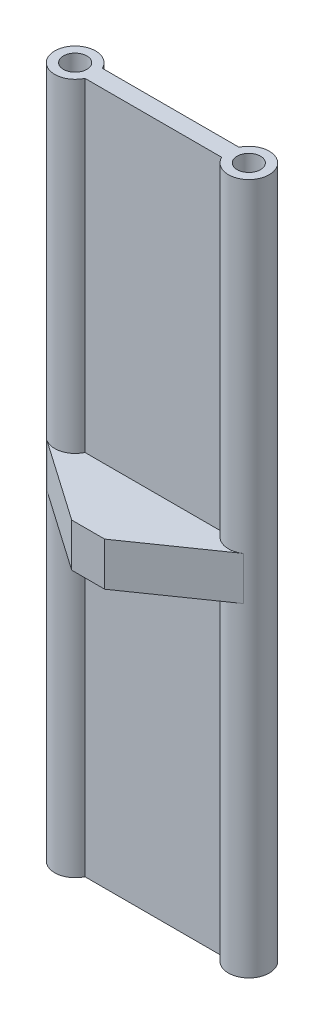
from build123d import *

# Parameters (mm, degrees)
SKETCH1_R           = 3.429
BOSS_EXTRUDE1_DEPTH = 202.2602
BOSS_EXTRUDE2_DEPTH = 6.35
CIRPATTERN1_COUNT   = 2


with BuildPart() as part:
    # Sketch1 → Boss-Extrude1 (new body)
    with BuildSketch(Plane(origin=(0, 0, 0), x_dir=(1, 0, 0), z_dir=(0, 1, 0))):
        with BuildLine():
            Line((19.998392739, 2.54), (-19.998392739, 2.54))
            ThreePointArc((-19.998392739, 2.54), (-31.369, 0), (-19.998392739, -2.54))
            Line((-19.998392739, -2.54), (19.998392739, -2.54))
            ThreePointArc((19.998392739, -2.54), (31.369, 0), (19.998392739, 2.54))
        make_face()
        with Locations((-25.4, 0)):
            Circle(SKETCH1_R, mode=Mode.SUBTRACT)
        with Locations((25.4, 0)):
            Circle(SKETCH1_R, mode=Mode.SUBTRACT)
    extrude(amount=BOSS_EXTRUDE1_DEPTH)

    # Sketch3 → Boss-Extrude2 (add, symmetric)
    with BuildSketch(Plane(origin=(0, 101.1301, 0), x_dir=(1, 0, 0), z_dir=(0, 1, 0))):
        with BuildLine():
            Line((-28.809566389, 4.899369147), (-4.826, 21.59))
            Line((-4.826, 21.59), (4.826, 21.59))
            Line((4.826, 21.59), (28.809566389, 4.899369147))
            ThreePointArc((28.809566389, 4.899369147), (23.85607241, 5.765869284), (19.998392739, 2.54))
            Line((19.998392739, 2.54), (-19.998392739, 2.54))
            ThreePointArc((-19.998392739, 2.54), (-23.85607241, 5.765869284), (-28.809566389, 4.899369147))
        make_face()
    boss_extrude2 = extrude(amount=BOSS_EXTRUDE2_DEPTH, both=True)

    # CirPattern1: Boss-Extrude2 ×2 about axis
    cirpattern1_axis = Axis((0, -10.11301, 0), (0, 1, 0))
    for i in range(1, CIRPATTERN1_COUNT):
        add(boss_extrude2.rotate(cirpattern1_axis, i * 360 / CIRPATTERN1_COUNT))


solid = part.part
